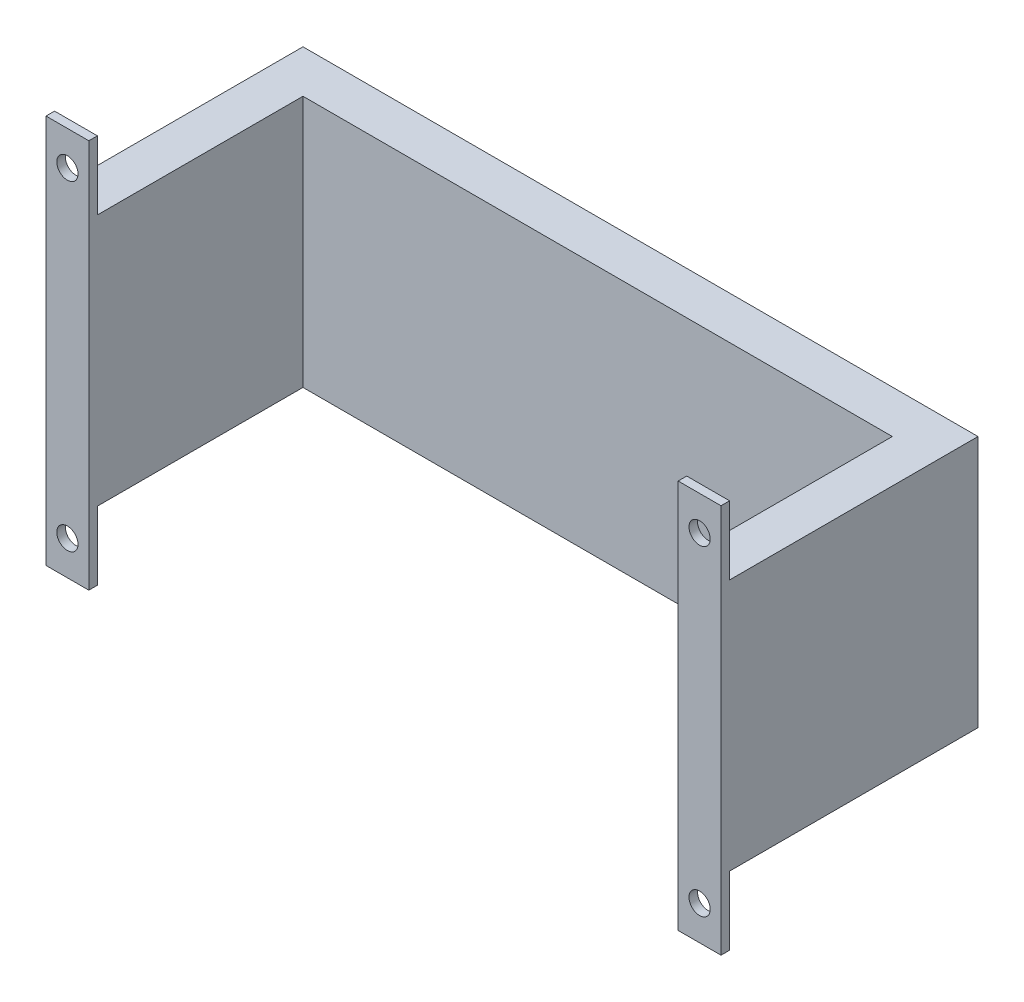
from build123d import *

# Parameters (mm, degrees)
SKETCH1_W           = 250.19
SKETCH1_H           = 93.472
BOSS_EXTRUDE1_DEPTH = 95.25
SKETCH5_W           = 218.44
SKETCH5_H           = 93.472
CUT_EXTRUDE1_DEPTH  = 79.375
SKETCH6_W           = 15.875
SKETCH6_H           = 25.4
BOSS_EXTRUDE2_DEPTH = 3.175
SKETCH7_R           = 3.937
CUT_EXTRUDE2_DEPTH  = 172.26052419


with BuildPart() as part:
    # Sketch1 → Boss-Extrude1 (new body)
    with BuildSketch(Plane.XY):
        Rectangle(SKETCH1_W, SKETCH1_H)
    extrude(amount=BOSS_EXTRUDE1_DEPTH)

    # Sketch5 → Cut-Extrude1 (cut)
    with BuildSketch(Plane.XY.offset(95.25)):
        Rectangle(SKETCH5_W, SKETCH5_H)
    extrude(amount=-CUT_EXTRUDE1_DEPTH, mode=Mode.SUBTRACT)

    # Sketch6 → Boss-Extrude2 (add)
    with BuildSketch(Plane.XY.offset(95.25)):
        with Locations((117.1575, 59.436)):
            Rectangle(SKETCH6_W, SKETCH6_H)
        with Locations((-117.1575, 59.436)):
            Rectangle(SKETCH6_W, SKETCH6_H)
        with Locations((117.1575, -59.436)):
            Rectangle(SKETCH6_W, SKETCH6_H)
        with Locations((-117.1575, -59.436)):
            Rectangle(SKETCH6_W, SKETCH6_H)
    extrude(amount=-BOSS_EXTRUDE2_DEPTH)

    # Sketch7 → Cut-Extrude2 (cut, through all)
    with BuildSketch(Plane(origin=(0, 0, 92.075), x_dir=(-1, 0, 0), z_dir=(0, 0, -1))):
        with Locations((117.1575, 59.436)):
            Circle(SKETCH7_R)
        with Locations(Location((-117.1575, 59.436, 0), (0, 0, 180))):
            Circle(SKETCH7_R)
        with Locations(Location((117.1575, -59.436, 0), (0, 0, 180))):
            Circle(SKETCH7_R)
        with Locations((-117.1575, -59.436)):
            Circle(SKETCH7_R)
    extrude(amount=-CUT_EXTRUDE2_DEPTH, mode=Mode.SUBTRACT)


solid = part.part
